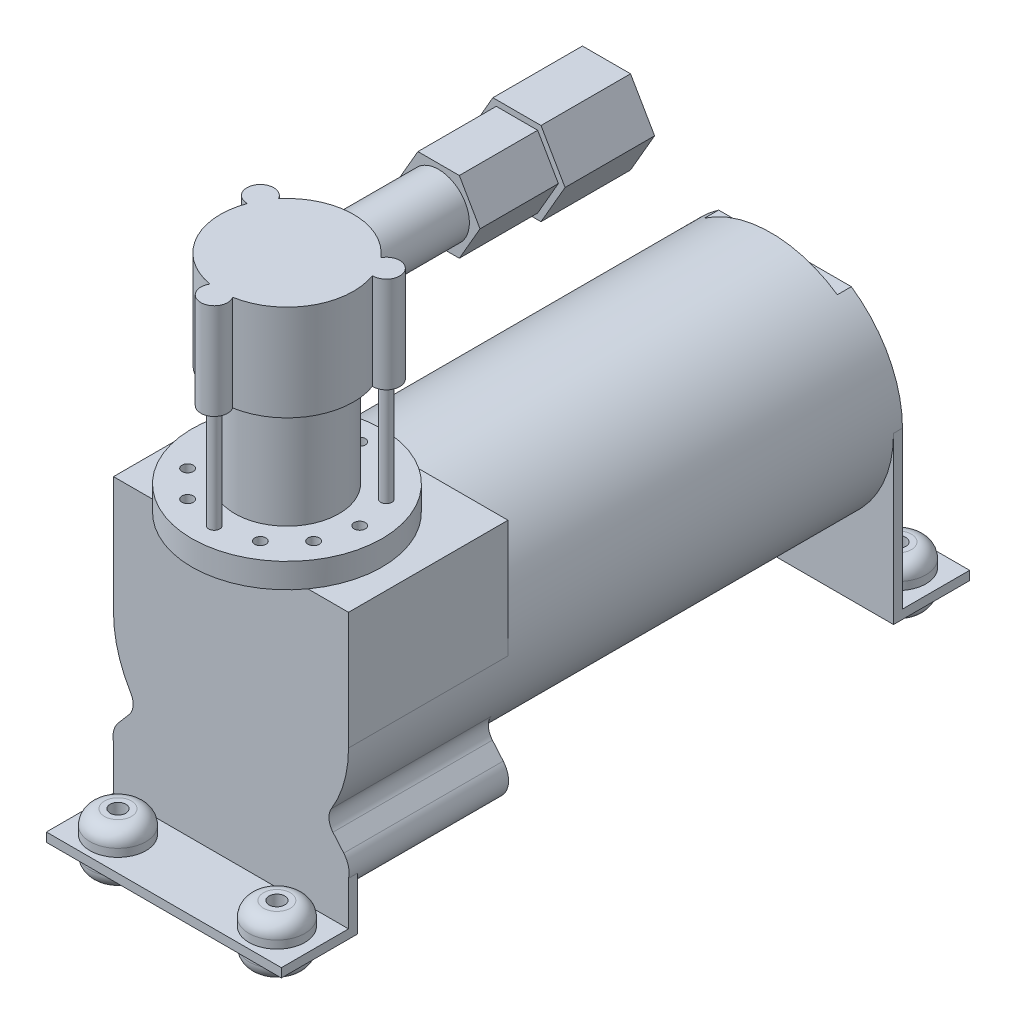
from build123d import *

# Parameters (mm, degrees)
SKETCH1_R                 = 26.67
BOSS_EXTRUDE1_DEPTH       = 62.865
BOSS_EXTRUDE2_DEPTH       = 36.195
BOSS_EXTRUDE4_START       = -2.032
BOSS_EXTRUDE4_DEPTH       = 2.032
SKETCH7_W                 = 53.34
SKETCH7_H                 = 2.032
BOSS_EXTRUDE5_DEPTH       = 15.24
BOSS_EXTRUDE6_DEPTH       = 2.032
CUT_EXTRUDE1_START        = -3.175
CUT_EXTRUDE1_DEPTH        = 3.175
SKETCH11_R                = 12.7
BOSS_EXTRUDE7_DEPTH       = 3.302
SKETCH12_R                = 1.778
CUT_EXTRUDE2_DEPTH        = 104.397500618
SKETCH13_W                = 4.572
SKETCH13_H                = 5.08
MIRROR4_COPY_1_SKETCH_W   = 4.572
MIRROR4_COPY_1_SKETCH_H   = 5.08
FILLET2_R                 = 3.302
SKETCH14_R                = 21.59
SKETCH14_R_2              = 11.811
BOSS_EXTRUDE8_DEPTH       = 5.588
SKETCH15_R                = 1.27
CUT_EXTRUDE3_DEPTH        = 5.588
CIRPATTERN1_COUNT         = 12
BOSS_EXTRUDE9_START       = 29.21
SKETCH16_R                = 11.811
SKETCH16_R_2              = 1.27
BOSS_EXTRUDE9_DEPTH       = 29.21
BOSS_EXTRUDE10_DEPTH      = 21.7678
BOSS_EXTRUDE11_DEPTH      = 19.304
BOSS_EXTRUDE11_DEPTH_BACK = 19.304
SKETCH19_R                = 6.985
BOSS_EXTRUDE12_DEPTH      = 17.78
SKETCH23_R                = 5.715
BOSS_EXTRUDE15_DEPTH      = 20.32


with BuildPart() as part:
    # Sketch1 → Boss-Extrude1 (new, symmetric)
    with BuildSketch(Plane.XY):
        Circle(SKETCH1_R)
    extrude(amount=BOSS_EXTRUDE1_DEPTH, both=True)

    # Sketch2 → Boss-Extrude2 (add)
    with BuildSketch(Plane.XY.offset(62.865)):
        with BuildLine():
            Line((26.67, 26.67), (0, 26.67))
            ThreePointArc((0, 26.67), (18.858537854, 18.858537854), (26.67, 0))
            Line((26.67, 0), (26.67, 26.67))
        make_face()
        with BuildLine():
            ThreePointArc((23.129196088, -18.326331253), (22.232442946, -16.15759753), (22.77673696, -13.87476679))
            ThreePointArc((22.77673696, -13.87476679), (17.688958427, -19.959700643), (11.036631134, -24.279243671))
            ThreePointArc((11.036631134, -24.279243671), (13.368332341, -24.013270658), (15.413562996, -25.164184959))
            Line((15.413562996, -25.164184959), (17.983306305, -27.949520455))
            ThreePointArc((17.983306305, -27.949520455), (25.086325415, -28.306672072), (25.585480583, -21.212217768))
            Line((25.585480583, -21.212217768), (23.129196088, -18.326331253))
        make_face()
    boss_extrude2 = extrude(amount=-BOSS_EXTRUDE2_DEPTH)

    # Mirror1: Boss-Extrude2 across plane
    add(boss_extrude2.mirror(Plane(origin=(0, 0, 0), x_dir=(0, 0, 1), z_dir=(1, 0, 0))))

    # Sketch6 → Boss-Extrude4 (add)
    with BuildSketch(Plane(origin=(0, 0, -62.865), x_dir=(-1, 0, 0), z_dir=(0, 0, -1)).offset(BOSS_EXTRUDE4_START)):
        with BuildLine():
            Line((-26.67, 0), (-26.67, -37.592))
            Line((-26.67, -37.592), (26.67, -37.592))
            Line((26.67, -37.592), (26.67, 0))
            ThreePointArc((26.67, 0), (0, -26.67), (-26.67, 0))
        make_face()
    extrude(amount=BOSS_EXTRUDE4_DEPTH)

    # Sketch7 → Boss-Extrude5 (add)
    with BuildSketch(Plane(origin=(0, 0, -62.865), x_dir=(-1, 0, 0), z_dir=(0, 0, -1))):
        with Locations((0, -36.576)):
            Rectangle(SKETCH7_W, SKETCH7_H)
    boss_extrude5 = extrude(amount=BOSS_EXTRUDE5_DEPTH)

    # Sketch9 → Boss-Extrude6 (add)
    with BuildSketch(Plane.XY.offset(62.865)):
        with BuildLine():
            Line((-15.413562996, -25.164184959), (-17.983306305, -27.949520455))
            ThreePointArc((-17.983306305, -27.949520455), (-23.025632829, -29.413376064), (-26.67, -25.633625022))
            Line((-26.67, -25.633625022), (-26.67, -37.592))
            Line((-26.67, -37.592), (26.67, -37.592))
            Line((26.67, -37.592), (26.67, -25.633625022))
            ThreePointArc((26.67, -25.633625022), (23.025632829, -29.413376064), (17.983306305, -27.949520455))
            Line((17.983306305, -27.949520455), (15.413562996, -25.164184959))
            ThreePointArc((15.413562996, -25.164184959), (13.368332341, -24.013270658), (11.036631134, -24.279243671))
            ThreePointArc((11.036631134, -24.279243671), (0, -26.67), (-11.036631134, -24.279243671))
            ThreePointArc((-11.036631134, -24.279243671), (-13.368332341, -24.013270658), (-15.413562996, -25.164184959))
        make_face()
    extrude(amount=-BOSS_EXTRUDE6_DEPTH)

    # Mirror2: Boss-Extrude5 across plane
    add(boss_extrude5.mirror(Plane.XY))

    # Sketch10 → Cut-Extrude1 (cut)
    with BuildSketch(Plane(origin=(0, 0, -62.865), x_dir=(-1, 0, 0), z_dir=(0, 0, -1)).offset(CUT_EXTRUDE1_START)):
        with BuildLine():
            Line((-15.062815713, 22.0091), (15.062815713, 22.0091))
            ThreePointArc((15.062815713, 22.0091), (0, 26.67), (-15.062815713, 22.0091))
        make_face()
    extrude(amount=CUT_EXTRUDE1_DEPTH, mode=Mode.SUBTRACT)

    # Sketch11 → Boss-Extrude7 (add)
    with BuildSketch(Plane(origin=(0, 0, -62.865), x_dir=(-1, 0, 0), z_dir=(0, 0, -1))):
        with Locations(Location((0, 0, 0), (0, 0, 180))):
            Circle(SKETCH11_R)
    extrude(amount=BOSS_EXTRUDE7_DEPTH)

    # Sketch12 → Cut-Extrude2 (cut, through all)
    with BuildSketch(Plane(origin=(0, -35.56, 0), x_dir=(1, 0, 0), z_dir=(0, 1, 0))):
        with Locations(Location((-18.034, -70.485, 0), (0, 0, 270))):
            Circle(SKETCH12_R)
        with Locations(Location((18.034, -70.485, 0), (0, 0, 270))):
            Circle(SKETCH12_R)
    extrude(amount=-CUT_EXTRUDE2_DEPTH, mode=Mode.SUBTRACT)

    # Sketch13 → Revolve1 (revolve)
    with BuildSketch(Plane.XY.offset(70.485), mode=Mode.PRIVATE) as revolve1_sk:
        with Locations((22.098, -33.02)):
            Rectangle(SKETCH13_W, SKETCH13_H)
        with Locations((22.098, -40.132)):
            Rectangle(SKETCH13_W, SKETCH13_H)
    revolve1 = revolve(revolve1_sk.sketch.rotate(Axis((18.034, -35.56, 70.485), (0, 1, 0)), 90), axis=Axis((18.034, -35.56, 70.485), (0, 1, 0)))

    # Mirror3: Revolve1 across plane
    add(revolve1.mirror(Plane(origin=(0, 0, 0), x_dir=(0, 0, 1), z_dir=(1, 0, 0))))

    # Mirror4: Revolve1 across plane
    add(revolve1.mirror(Plane.XY))

    # Mirror4 copy 1 sketch → Mirror4 copy 1 (revolve)
    with BuildSketch(Plane(origin=(0, 0, -70.485), x_dir=(-1, 0, 0), z_dir=(0, 0, -1))):
        with Locations((22.098, -33.02)):
            Rectangle(MIRROR4_COPY_1_SKETCH_W, MIRROR4_COPY_1_SKETCH_H)
        with Locations((22.098, -40.132)):
            Rectangle(MIRROR4_COPY_1_SKETCH_W, MIRROR4_COPY_1_SKETCH_H)
    revolve(axis=Axis((-18.034, -35.56, -70.485), (0, 1, 0)))

    # Fillet2
    fillet2_edges = [part.edges().sort_by_distance(p)[0] for p in [
        (18.034, -30.48, 76.835),
        (18.034, -42.672, 76.835),
        (-18.034, -30.48, 76.835),
        (-18.034, -42.672, 76.835),
        (-11.684, -30.48, -70.485),
        (-11.684, -42.672, -70.485),
        (18.034, -30.48, -76.835),
        (18.034, -42.672, -76.835),
    ]]
    fillet(fillet2_edges, radius=FILLET2_R)

    # Sketch14 → Boss-Extrude8 (add)
    with BuildSketch(Plane(origin=(0, 26.67, 0), x_dir=(1, 0, 0), z_dir=(0, 1, 0))):
        with Locations(Location((0, -50.165, 0), (0, 0, 216.031879072))):
            Circle(SKETCH14_R)
        with Locations(Location((0, -50.165, 0), (0, 0, 270))):
            Circle(SKETCH14_R_2, mode=Mode.SUBTRACT)
    extrude(amount=BOSS_EXTRUDE8_DEPTH)

    # Sketch15 → Cut-Extrude3 (cut)
    with BuildSketch(Plane(origin=(0, 32.258, 0), x_dir=(1, 0, 0), z_dir=(0, 1, 0))):
        with Locations(Location((0, -33.655, 0), (0, 0, 270))):
            Circle(SKETCH15_R)
    cut_extrude3 = extrude(amount=-CUT_EXTRUDE3_DEPTH, mode=Mode.SUBTRACT)

    # CirPattern1: Cut-Extrude3 ×12 about axis
    cirpattern1_axis = Axis((0, 0, 50.165), (0, 1, 0))
    for i in range(1, CIRPATTERN1_COUNT):
        add(cut_extrude3.rotate(cirpattern1_axis, i * 360 / CIRPATTERN1_COUNT), mode=Mode.SUBTRACT)

    # Sketch16 → Boss-Extrude9 (add)
    with BuildSketch(Plane(origin=(0, 26.67, 0), x_dir=(1, 0, 0), z_dir=(0, 1, 0)).offset(BOSS_EXTRUDE9_START)):
        with Locations(Location((0, -50.165, 0), (0, 0, 90))):
            Circle(SKETCH16_R)
        with Locations(Location((0, -66.675, 0), (0, 0, 90))):
            Circle(SKETCH16_R_2)
        with Locations(Location((-14.298079416, -41.91, 0), (0, 0, 90))):
            Circle(SKETCH16_R_2)
        with Locations(Location((14.298079416, -41.91, 0), (0, 0, 90))):
            Circle(SKETCH16_R_2)
    extrude(amount=-BOSS_EXTRUDE9_DEPTH)

    # Sketch18 → Boss-Extrude10 (add)
    with BuildSketch(Plane(origin=(0, 55.88, 0), x_dir=(1, 0, 0), z_dir=(0, 1, 0))):
        with BuildLine():
            ThreePointArc((2.582311646, -65.05575), (13.088241927, -57.7215), (14.186923604, -44.955972486))
            ThreePointArc((14.186923604, -44.955972486), (16.937724847, -40.386), (11.604611958, -40.483277514))
            ThreePointArc((11.604611958, -40.483277514), (0, -35.052), (-11.604611958, -40.483277514))
            ThreePointArc((-11.604611958, -40.483277514), (-16.937724847, -40.386), (-14.186923604, -44.955972486))
            ThreePointArc((-14.186923604, -44.955972486), (-13.088241927, -57.7215), (-2.582311646, -65.05575))
            ThreePointArc((-2.582311646, -65.05575), (0, -69.723), (2.582311646, -65.05575))
        make_face()
    extrude(amount=BOSS_EXTRUDE10_DEPTH)

    # Sketch19 → Boss-Extrude11 (add, two sides: drawn at the far end of the back side and taken through both)
    with BuildSketch(Plane(origin=(0, 0, 35.052), x_dir=(-1, 0, 0), z_dir=(0, 0, -1)).offset(-BOSS_EXTRUDE11_DEPTH_BACK)):
        with Locations(Location((0, 69.85, 0), (0, 0, 180))):
            Circle(SKETCH19_R)
    extrude(amount=BOSS_EXTRUDE11_DEPTH + BOSS_EXTRUDE11_DEPTH_BACK)

    # Sketch20 → Boss-Extrude12 (add)
    with BuildSketch(Plane(origin=(0, 0, 15.748), x_dir=(-1, 0, 0), z_dir=(0, 0, -1))):
        Polygon((4.699, 61.711093255), (9.398, 69.85), (4.699, 77.988906745), (-4.699, 77.988906745), (-9.398, 69.85), (-4.699, 61.711093255), align=None)
    extrude(amount=BOSS_EXTRUDE12_DEPTH)

    # Sketch23 → Boss-Extrude15 (add)
    with BuildSketch(Plane(origin=(0, 0, -2.032), x_dir=(-1, 0, 0), z_dir=(0, 0, -1))):
        Polygon((10.922, 69.85), (5.461, 79.30872946), (-5.461, 79.30872946), (-10.922, 69.85), (-5.461, 60.39127054), (5.461, 60.39127054), align=None)
        with Locations((0, 69.85)):
            Circle(SKETCH23_R, mode=Mode.SUBTRACT)
    extrude(amount=BOSS_EXTRUDE15_DEPTH)


solid = part.part
